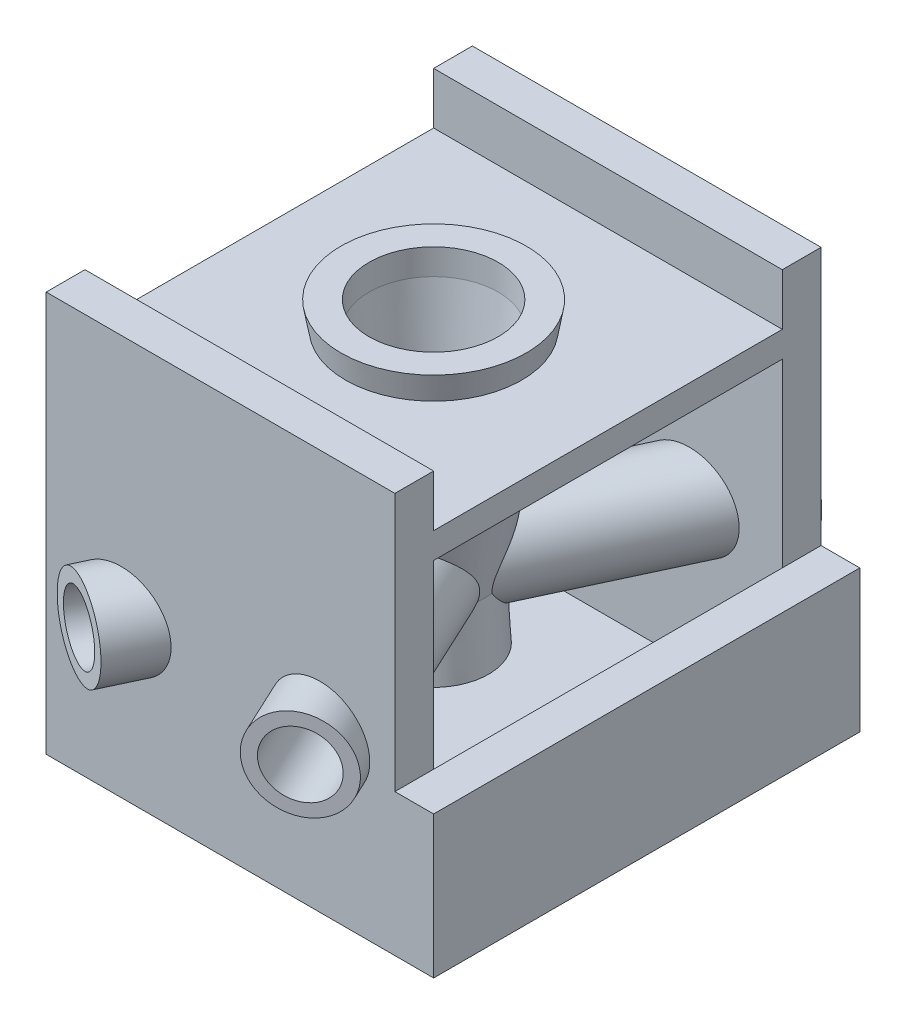
from build123d import *

# Parameters (mm, degrees)
SKETCH1_W                      = 33
SKETCH1_H                      = 33
SKETCH1_W_2                    = 27
SKETCH1_H_2                    = 27
BOSS_EXTRUDE1_DEPTH            = 30
SKETCH3_W                      = 27
SKETCH3_H                      = 30
CUT_EXTRUDE1_DEPTH             = 30
SKETCH4_W                      = 33
SKETCH4_H                      = 1
BOSS_EXTRUDE2_DEPTH            = 33
BOSS_EXTRUDE4_DEPTH            = 4.8
CUT_EXTRUDE3_DEPTH             = 2.8
BOSS_EXTRUDE5_DEPTH            = 4.8
CUT_EXTRUDE5_DEPTH             = 2.8
SKETCH12_W                     = 3
SKETCH12_H                     = 27
CUT_EXTRUDE6_DEPTH             = 10
SKETCH13_W                     = 3
SKETCH13_H                     = 37.394696754
CUT_EXTRUDE7_DEPTH             = 39.800773188
BOSS_EXTRUDE8_DEPTH            = 27
SKETCH30_R                     = 3.5
SKETCH30_R_2                   = 2.5
BOSS_EXTRUDE15_DEPTH           = 42
SKETCH31_R                     = 3.5
SKETCH31_R_2                   = 2.5
BOSS_EXTRUDE16_DEPTH           = 42
SKETCH38_R                     = 4
BOSS_EXTRUDE17_DEPTH           = 5
BOSS_EXTRUDE17_TAPER           = -3
BOSS_EXTRUDE17_OTHER_WAY_DEPTH = 18
BOSS_EXTRUDE17_OTHER_WAY_TAPER = -10
SKETCH37_R                     = 2.5
CUT_EXTRUDE14_DEPTH            = 56.68070608
SKETCH36_R                     = 2.5
CUT_EXTRUDE13_DEPTH            = 56.68070608
SKETCH39_R                     = 2
CUT_EXTRUDE15_DEPTH            = 6
CUT_EXTRUDE15_TAPER            = -4
CUT_EXTRUDE15_OTHER_WAY_DEPTH  = 6
CUT_EXTRUDE15_OTHER_WAY_TAPER  = -4
SKETCH27_R                     = 5
CUT_EXTRUDE12_DEPTH            = 16
CUT_EXTRUDE12_TAPER            = 8
CUT_EXTRUDE12_OTHER_WAY_DEPTH  = 5
CUT_EXTRUDE16_DEPTH            = 20


with BuildPart() as part:
    # Sketch1 → Boss-Extrude1 (new body)
    with BuildSketch(Plane(origin=(0, 0, 0), x_dir=(1, 0, 0), z_dir=(0, 1, 0))):
        Rectangle(SKETCH1_W, SKETCH1_H)
        Rectangle(SKETCH1_W_2, SKETCH1_H_2, mode=Mode.SUBTRACT)
    extrude(amount=BOSS_EXTRUDE1_DEPTH)

    # Sketch3 → Cut-Extrude1 (cut)
    with BuildSketch(Plane(origin=(-13.5, 0, 0), x_dir=(0, 0, -1), z_dir=(1, 0, 0))):
        with Locations((0, 15)):
            Rectangle(SKETCH3_W, SKETCH3_H)
    extrude(amount=-CUT_EXTRUDE1_DEPTH, mode=Mode.SUBTRACT)

    # Sketch4 → Boss-Extrude2 (add)
    with BuildSketch(Plane(origin=(16.5, 0, 0), x_dir=(0, 0, -1), z_dir=(1, 0, 0))):
        with Locations((0, -0.5)):
            Rectangle(SKETCH4_W, SKETCH4_H)
    extrude(amount=-BOSS_EXTRUDE2_DEPTH)

    # Sketch7 → Boss-Extrude4 (add)
    with BuildSketch(Plane(origin=(0, 0, 0), x_dir=(1, 0, 0), z_dir=(0, 1, 0))):
        Polygon((13.5, 13.5), (9.5, 13.5), (13.5, 9.5), align=None)
    extrude(amount=BOSS_EXTRUDE4_DEPTH)

    # Sketch8 → Cut-Extrude3 (cut)
    with BuildSketch(Plane(origin=(0, 0, 0), x_dir=(1, 0, 0), z_dir=(0, 1, 0))):
        Polygon((13.5, 9.5), (9.5, 13.5), (13.5, 13.5), align=None)
    extrude(amount=CUT_EXTRUDE3_DEPTH, mode=Mode.SUBTRACT)

    # Sketch9 → Boss-Extrude5 (add)
    with BuildSketch(Plane(origin=(0, 0, 0), x_dir=(1, 0, 0), z_dir=(0, 1, 0))):
        Polygon((13.5, -13.5), (13.5, -9.5), (9.5, -13.5), align=None)
    extrude(amount=BOSS_EXTRUDE5_DEPTH)

    # Sketch10 → Cut-Extrude5 (cut)
    with BuildSketch(Plane(origin=(0, 0, 0), x_dir=(1, 0, 0), z_dir=(0, 1, 0))):
        Polygon((9.5, -13.5), (13.5, -9.5), (13.5, -13.5), align=None)
    extrude(amount=CUT_EXTRUDE5_DEPTH, mode=Mode.SUBTRACT)

    # Sketch12 → Cut-Extrude6 (cut)
    with BuildSketch(Plane(origin=(0, 0, 0), x_dir=(1, 0, 0), z_dir=(0, 1, 0))):
        with Locations((-15, 0)):
            Rectangle(SKETCH12_W, SKETCH12_H)
    extrude(amount=-CUT_EXTRUDE6_DEPTH, mode=Mode.SUBTRACT)

    # Sketch13 → Cut-Extrude7 (cut, through all)
    with BuildSketch(Plane.XZ.offset(1)):
        with Locations((-15, -2.197348377)):
            Rectangle(SKETCH13_W, SKETCH13_H)
    extrude(amount=-CUT_EXTRUDE7_DEPTH, mode=Mode.SUBTRACT)

    # Sketch26 → Boss-Extrude8 (add, through all)
    with BuildSketch(Plane.ZY.offset(-13.5)):
        Polygon((13.5, 26), (-13.5, 26), (-13.5, 24), (0, 24), (13.5, 24), align=None)
    extrude(amount=BOSS_EXTRUDE8_DEPTH)



with BuildPart() as body_2:
    # Sketch30 → Boss-Extrude15 (new body)
    with BuildSketch(Plane(origin=(-8.73105029, 0, 18.723797771), x_dir=(0, -1, 0), z_dir=(-0.4226182617406972, 0, 0.9063077870366512))):
        with Locations(Location((-11, 0, 0), (0, 0, 90))):
            Circle(SKETCH30_R)
        with Locations(Location((-11, 0, 0), (0, 0, 90))):
            Circle(SKETCH30_R_2, mode=Mode.SUBTRACT)
    extrude(amount=-BOSS_EXTRUDE15_DEPTH)


with BuildPart() as part_1:
    add(part.part)

    add(body_2.part)  # Boss-Extrude16 merges body 2
    # Sketch31 → Boss-Extrude16 (add)
    with BuildSketch(Plane(origin=(-8.73105029, 0, -18.723797771), x_dir=(0, 1, 0), z_dir=(-0.422618261740704, 0, -0.9063077870366479))):
        with Locations(Location((11, 0, 0), (0, 0, 270))):
            Circle(SKETCH31_R)
        with Locations(Location((11, 0, 0), (0, 0, 270))):
            Circle(SKETCH31_R_2, mode=Mode.SUBTRACT)
    extrude(amount=-BOSS_EXTRUDE16_DEPTH)

    # Sketch38 → Boss-Extrude17 (add)
    with BuildSketch(Plane(origin=(0, 10, 0), x_dir=(1, 0, 0), z_dir=(0, 1, 0))):
        Circle(SKETCH38_R)
    extrude(amount=-BOSS_EXTRUDE17_DEPTH, taper=BOSS_EXTRUDE17_TAPER)

    # Sketch38 → Boss-Extrude17 other way (add)
    with BuildSketch(Plane(origin=(0, 10, 0), x_dir=(1, 0, 0), z_dir=(0, 1, 0))):
        Circle(SKETCH38_R)
    extrude(amount=BOSS_EXTRUDE17_OTHER_WAY_DEPTH, taper=BOSS_EXTRUDE17_OTHER_WAY_TAPER)

    # Sketch37 → Cut-Extrude14 (cut, through all)
    with BuildSketch(Plane(origin=(-8.73105029, 0, -18.723797771), x_dir=(0, 1, 0), z_dir=(-0.422618261740704, 0, -0.9063077870366479))):
        with Locations(Location((11, 0, 0), (0, 0, 270))):
            Circle(SKETCH37_R)
    extrude(amount=-CUT_EXTRUDE14_DEPTH, mode=Mode.SUBTRACT)

    # Sketch36 → Cut-Extrude13 (cut, through all)
    with BuildSketch(Plane(origin=(-8.73105029, 0, 18.723797771), x_dir=(0, -1, 0), z_dir=(-0.4226182617406972, 0, 0.9063077870366512))):
        with Locations(Location((-11, 0, 0), (0, 0, 90))):
            Circle(SKETCH36_R)
    extrude(amount=-CUT_EXTRUDE13_DEPTH, mode=Mode.SUBTRACT)

    # Sketch39 → Cut-Extrude15 (cut)
    with BuildSketch(Plane(origin=(0, 10, 0), x_dir=(1, 0, 0), z_dir=(0, 1, 0))):
        Circle(SKETCH39_R)
    extrude(amount=-CUT_EXTRUDE15_DEPTH, taper=CUT_EXTRUDE15_TAPER, mode=Mode.SUBTRACT)

    # Sketch39 → Cut-Extrude15 other way (cut)
    with BuildSketch(Plane(origin=(0, 10, 0), x_dir=(1, 0, 0), z_dir=(0, 1, 0))):
        Circle(SKETCH39_R)
    extrude(amount=CUT_EXTRUDE15_OTHER_WAY_DEPTH, taper=CUT_EXTRUDE15_OTHER_WAY_TAPER, mode=Mode.SUBTRACT)

    # Sketch27 → Cut-Extrude12 (cut)
    with BuildSketch(Plane(origin=(0, 26, 0), x_dir=(1, 0, 0), z_dir=(0, 1, 0))):
        with Locations(Location((0, 0, 0), (0, 0, 270))):
            Circle(SKETCH27_R)
    extrude(amount=-CUT_EXTRUDE12_DEPTH, taper=CUT_EXTRUDE12_TAPER, mode=Mode.SUBTRACT)

    # Sketch27 → Cut-Extrude12 other way (cut)
    with BuildSketch(Plane(origin=(0, 26, 0), x_dir=(1, 0, 0), z_dir=(0, 1, 0))):
        with Locations(Location((0, 0, 0), (0, 0, 270))):
            Circle(SKETCH27_R)
    extrude(amount=CUT_EXTRUDE12_OTHER_WAY_DEPTH, mode=Mode.SUBTRACT)

    # Sketch40 → Cut-Extrude16 (cut)
    with BuildSketch(Plane(origin=(0, 30, 0), x_dir=(1, 0, 0), z_dir=(0, 1, 0))):
        Polygon((13.5, 13.5), (13.5, 18.422264046), (20.558156502, 18.422264046), (20.558156502, -21.180638081), (13.5, -21.180638081), (13.5, -13.5), align=None)
    extrude(amount=-CUT_EXTRUDE16_DEPTH, mode=Mode.SUBTRACT)


solid = part_1.part
